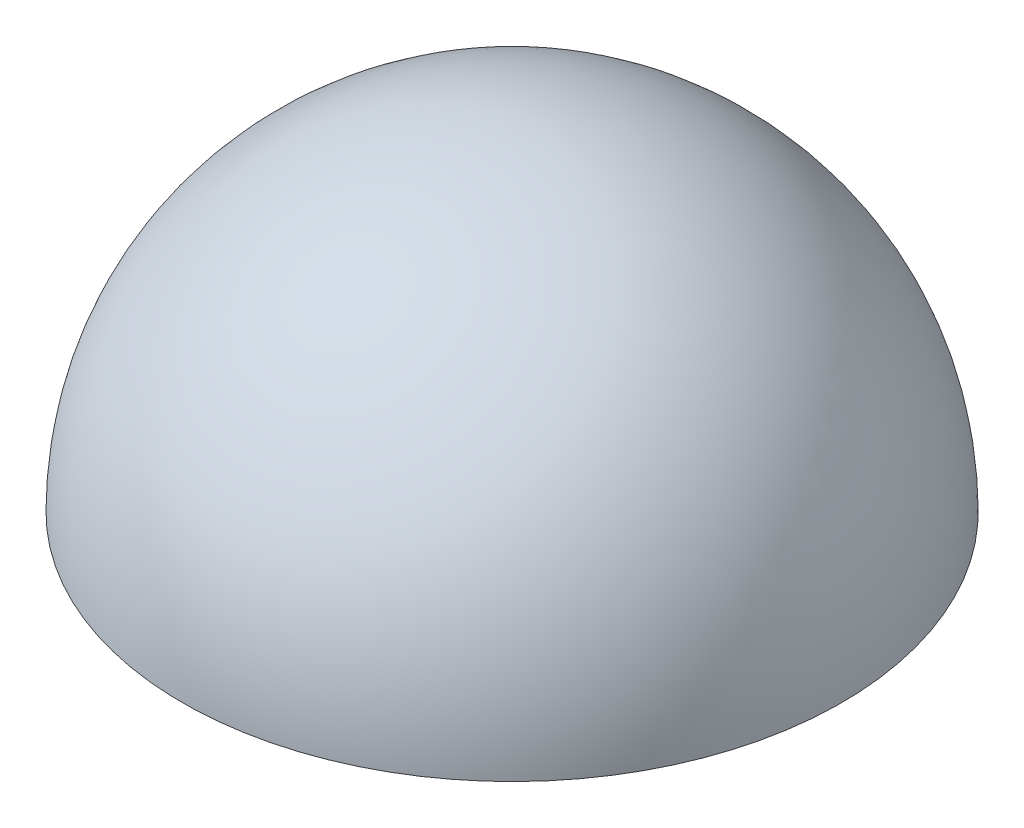
from build123d import *

# Parameters (mm, degrees)
REVOLVE_1_ANGLE = 180
SHELL_3_T       = -1


with BuildPart() as part:
    # 草图1 → 旋转1 (revolve)
    with BuildSketch(Plane(origin=(0, 0, 0), x_dir=(1, 0, 0), z_dir=(0, 1, 0))):
        with BuildLine():
            Line((0, 0), (0, -94))
            ThreePointArc((0, -94), (47, -47), (0, 0))
        make_face()
    revolve(axis=Axis((0, 0, 0), (0, 0, 1)), revolution_arc=REVOLVE_1_ANGLE)

    # 抽壳3
    shell_3_openings = [part.faces().sort_by_distance(p)[0] for p in [
        (0, 0, 47),
    ]]
    offset(amount=SHELL_3_T, openings=shell_3_openings)


solid = part.part
